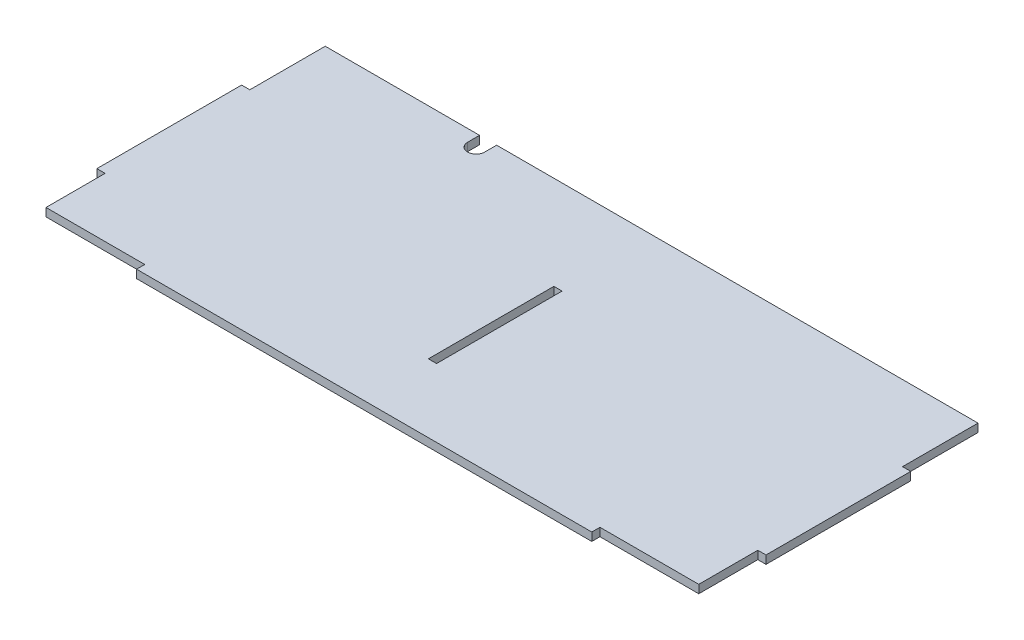
from build123d import *

# Parameters (mm, degrees)
SKETCH1_W           = 490
SKETCH1_H           = 210.49
BOSS_EXTRUDE1_DEPTH = 6
SKETCH2_W           = 6
SKETCH2_H           = 55.25
CUT_EXTRUDE1_DEPTH  = 534.331079256
SKETCH3_W           = 6
SKETCH3_H           = 91.92
CUT_EXTRUDE2_DEPTH  = 534.331079256
CUT_EXTRUDE3_DEPTH  = 534.331079256


with BuildPart() as part:
    # Sketch1 → Boss-Extrude1 (new body)
    with BuildSketch(Plane(origin=(0, 0, 0), x_dir=(1, 0, 0), z_dir=(0, 1, 0))):
        with Locations((245, 105.245)):
            Rectangle(SKETCH1_W, SKETCH1_H)
    extrude(amount=BOSS_EXTRUDE1_DEPTH)

    # Sketch2 → Cut-Extrude1 (cut, through all)
    with BuildSketch(Plane(origin=(0, 6, 0), x_dir=(1, 0, 0), z_dir=(0, 1, 0))):
        Polygon((411.666666663, 6), (411.666666663, 0), (490, 0), (490, 49.25), (484, 49.25), (484, 6), align=None)
        Polygon((0, 49.25), (0, 0), (78.33333333, 0), (78.33333333, 6), (6, 6), (6, 49.25), align=None)
        with Locations((487, 182.865)):
            Rectangle(SKETCH2_W, SKETCH2_H)
        with Locations((3, 182.865)):
            Rectangle(SKETCH2_W, SKETCH2_H)
    extrude(amount=-CUT_EXTRUDE1_DEPTH, mode=Mode.SUBTRACT)

    # Sketch3 → Cut-Extrude2 (cut, through all)
    with BuildSketch(Plane(origin=(0, 6, 0), x_dir=(1, 0, 0), z_dir=(0, 1, 0))):
        with Locations((245, 95.96)):
            Rectangle(SKETCH3_W, SKETCH3_H)
    extrude(amount=-CUT_EXTRUDE2_DEPTH, mode=Mode.SUBTRACT)

    # Sketch4 → Cut-Extrude3 (cut, through all)
    with BuildSketch(Plane(origin=(0, 6, 0), x_dir=(1, 0, 0), z_dir=(0, 1, 0))):
        with BuildLine():
            Line((119, 210.49), (119, 201.74))
            ThreePointArc((119, 201.74), (125.25, 195.49), (131.5, 201.74))
            Line((131.5, 201.74), (131.5, 210.49))
            Line((131.5, 210.49), (119, 210.49))
        make_face()
    extrude(amount=-CUT_EXTRUDE3_DEPTH, mode=Mode.SUBTRACT)


solid = part.part
